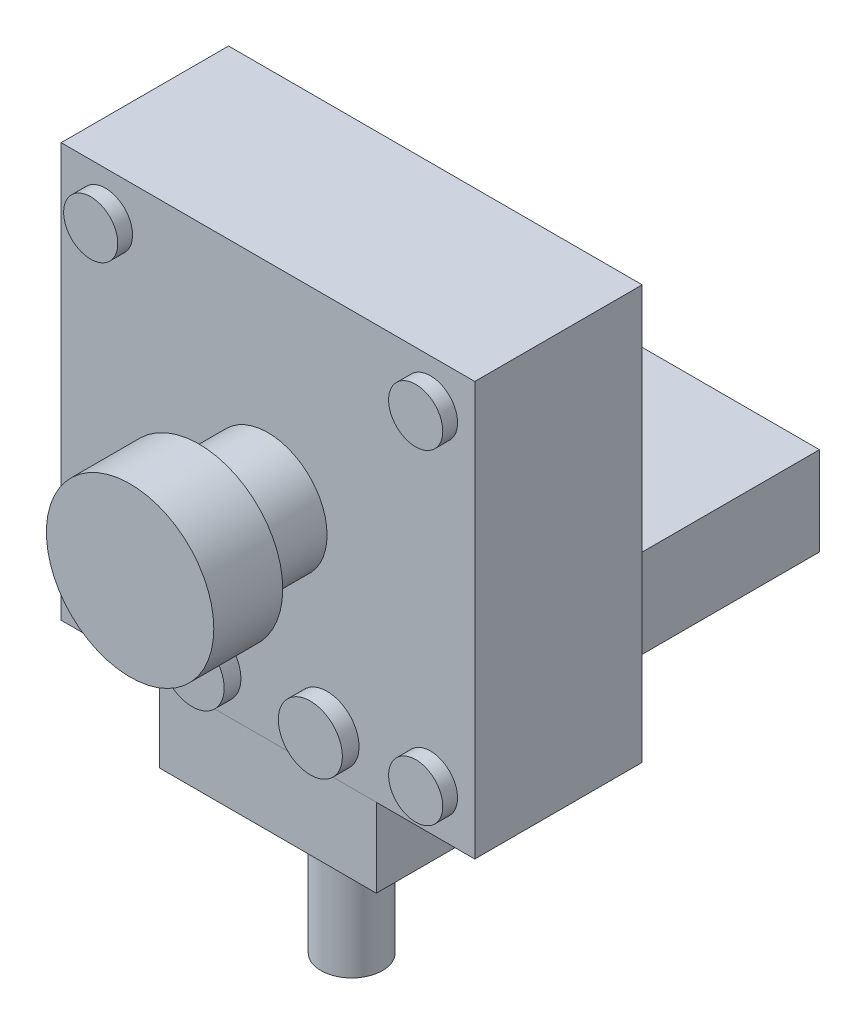
from build123d import *

# Parameters (mm, degrees)
SKETCH1_W               = 42
SKETCH1_H               = 42
BOX_DEPTH               = 17
SKETCH2_R               = 6
LENS_DEPTH              = 7
SKETCH3_R               = 8.5
LENS_CAP_DEPTH          = 7
SKETCH4_W               = 22
SKETCH4_H               = 17
ADAPTER_DEPTH           = 8
SKETCH5_R               = 3.125
BOLT_DEPTH              = 15
SKETCH6_W               = 19
SKETCH6_H               = 3.5
USB_CONNECTOR_DEPTH     = 2.5
SKETCH7_W               = 23
SKETCH7_H               = 9
USB_HEAD_DEPTH          = 25
HOUSE_SCREWS_DEPTH      = 1.5
HOUSE_SCREWS_DEPTH_BACK = 18.5
SKETCH8_R               = 2.75
SKETCH9_R               = 3.25
ADAPTER_SKREWS_DEPTH    = 1.7


with BuildPart() as part:
    # Sketch1 → Box (new body)
    with BuildSketch(Plane.XY):
        with Locations((21, 21)):
            Rectangle(SKETCH1_W, SKETCH1_H)
    extrude(amount=BOX_DEPTH)

    # Sketch8 → House_screws (add, two sides: drawn at the far end of the back side and taken through both)
    with BuildSketch(Plane.XY.offset(17).offset(-HOUSE_SCREWS_DEPTH_BACK)):
        with Locations(Location((4.5, 4.5, 0), (0, 0, 180))):
            Circle(SKETCH8_R)
        with Locations(Location((37.5, 4.5, 0), (0, 0, 180))):
            Circle(SKETCH8_R)
        with Locations(Location((37.5, 37.5, 0), (0, 0, 180))):
            Circle(SKETCH8_R)
        with Locations(Location((4.5, 37.5, 0), (0, 0, 180))):
            Circle(SKETCH8_R)
    extrude(amount=HOUSE_SCREWS_DEPTH + HOUSE_SCREWS_DEPTH_BACK)

    # Sketch9 → Adapter_skrews (add)
    with BuildSketch(Plane.XY.offset(17)):
        with Locations(Location((15, 4, 0), (0, 0, 180))):
            Circle(SKETCH9_R)
        with Locations(Location((27, 4, 0), (0, 0, 180))):
            Circle(SKETCH9_R)
    extrude(amount=ADAPTER_SKREWS_DEPTH)


with BuildPart() as body_2:
    # Sketch2 → Lens (new body)
    with BuildSketch(Plane.XY.offset(17)):
        with Locations((21, 21)):
            Circle(SKETCH2_R)
    extrude(amount=LENS_DEPTH)


with BuildPart() as body_3:
    # Sketch3 → Lens cap (new body)
    with BuildSketch(Plane.XY.offset(24)):
        with Locations((21, 21)):
            Circle(SKETCH3_R)
    extrude(amount=LENS_CAP_DEPTH)


with BuildPart() as body_4:
    # Sketch4 → Adapter (new body)
    with BuildSketch(Plane.XZ):
        with Locations((21, 8.5)):
            Rectangle(SKETCH4_W, SKETCH4_H)
    extrude(amount=ADAPTER_DEPTH)

    # Sketch5 → Bolt (add)
    with BuildSketch(Plane.XZ.offset(8)):
        with Locations(Location((21, 8.5, 0), (0, 0, 270))):
            Circle(SKETCH5_R)
    extrude(amount=BOLT_DEPTH)


with BuildPart() as body_5:
    # Sketch6 → USB_connector (new body)
    with BuildSketch(Plane(origin=(0, 0, 0), x_dir=(-1, 0, 0), z_dir=(0, 0, -1))):
        with Locations((-21, 4.5)):
            Rectangle(SKETCH6_W, SKETCH6_H)
    extrude(amount=USB_CONNECTOR_DEPTH)

    # Sketch7 → USB_head (add)
    with BuildSketch(Plane(origin=(0, 0, -2.5), x_dir=(-1, 0, 0), z_dir=(0, 0, -1))):
        with Locations((-21, 4.5)):
            Rectangle(SKETCH7_W, SKETCH7_H)
    extrude(amount=USB_HEAD_DEPTH)


solid = Compound([part.part, body_2.part, body_3.part, body_4.part, body_5.part])
